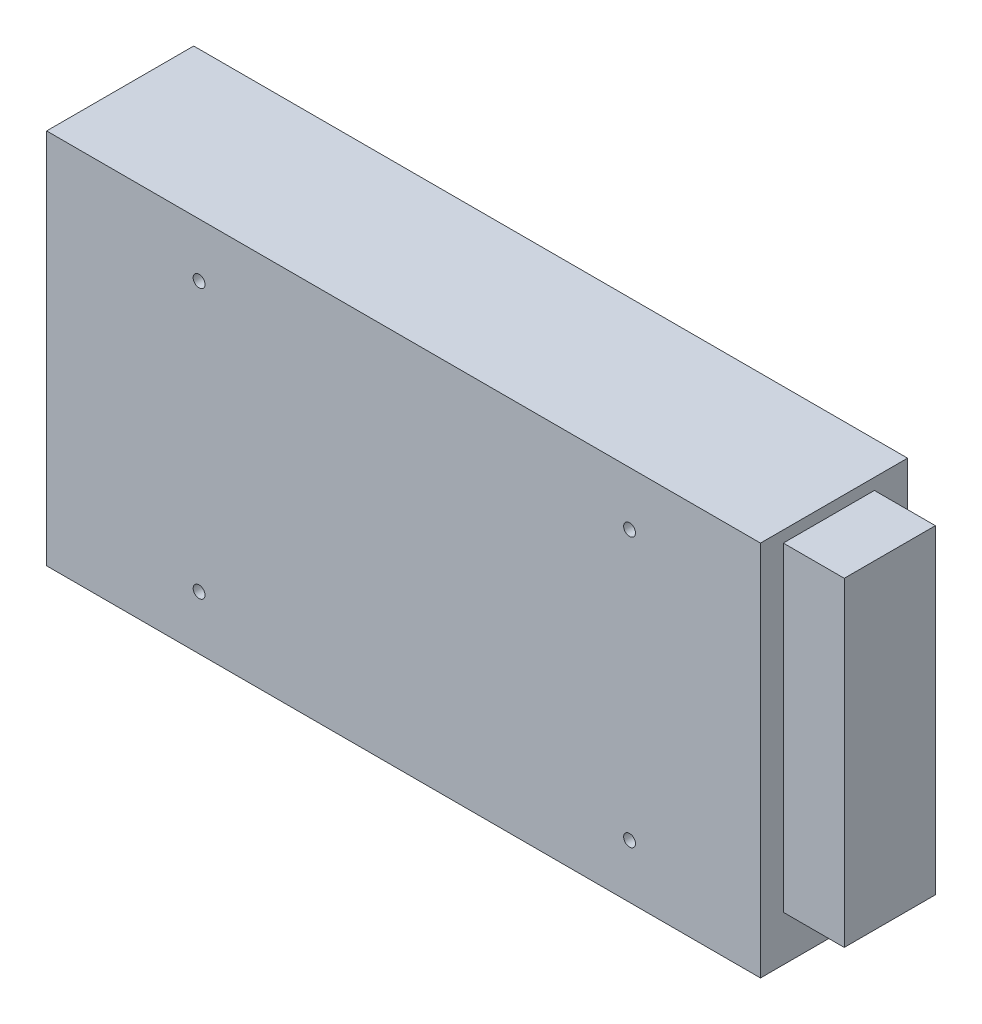
from build123d import *

# Parameters (mm, degrees)
SKETCH1_W                 = 199
SKETCH1_H                 = 41
BOSS_EXTRUDE1_DEPTH       = 52.5
SKETCH10_W                = 25.4
SKETCH10_H                = 89.125
BOSS_EXTRUDE6_DEPTH       = 17
M4X0_7_TAPPED_HOLE1_D     = 3.3
M4X0_7_TAPPED_HOLE1_DEPTH = 9.906
M4X0_7_TAPPED_HOLE1_TIP   = 0.991420021


with BuildPart() as part:
    # Sketch1 → Boss-Extrude1 (new, symmetric)
    with BuildSketch(Plane(origin=(0, 0, 0), x_dir=(1, 0, 0), z_dir=(0, 1, 0))):
        Rectangle(SKETCH1_W, SKETCH1_H)
    extrude(amount=BOSS_EXTRUDE1_DEPTH, both=True)

    # Sketch10 → Boss-Extrude6 (add)
    with BuildSketch(Plane(origin=(99.5, 0, 0), x_dir=(0, 0, -1), z_dir=(1, 0, 0))):
        with Locations((-1.45, 4.7625)):
            Rectangle(SKETCH10_W, SKETCH10_H)
    extrude(amount=BOSS_EXTRUDE6_DEPTH)

    # M4x0.7 Tapped Hole1
    with Locations(Plane.XY.offset(20.5)):
        with Locations((-57, 37.5), (63, -37.5), (-57, -37.5), (63, 37.5)):
            Hole(M4X0_7_TAPPED_HOLE1_D / 2, depth=M4X0_7_TAPPED_HOLE1_DEPTH)
            with Locations((0, 0, -(M4X0_7_TAPPED_HOLE1_DEPTH + M4X0_7_TAPPED_HOLE1_TIP / 2))):  # 118° drill point
                Cone(0, M4X0_7_TAPPED_HOLE1_D / 2, M4X0_7_TAPPED_HOLE1_TIP, mode=Mode.SUBTRACT)


solid = part.part
